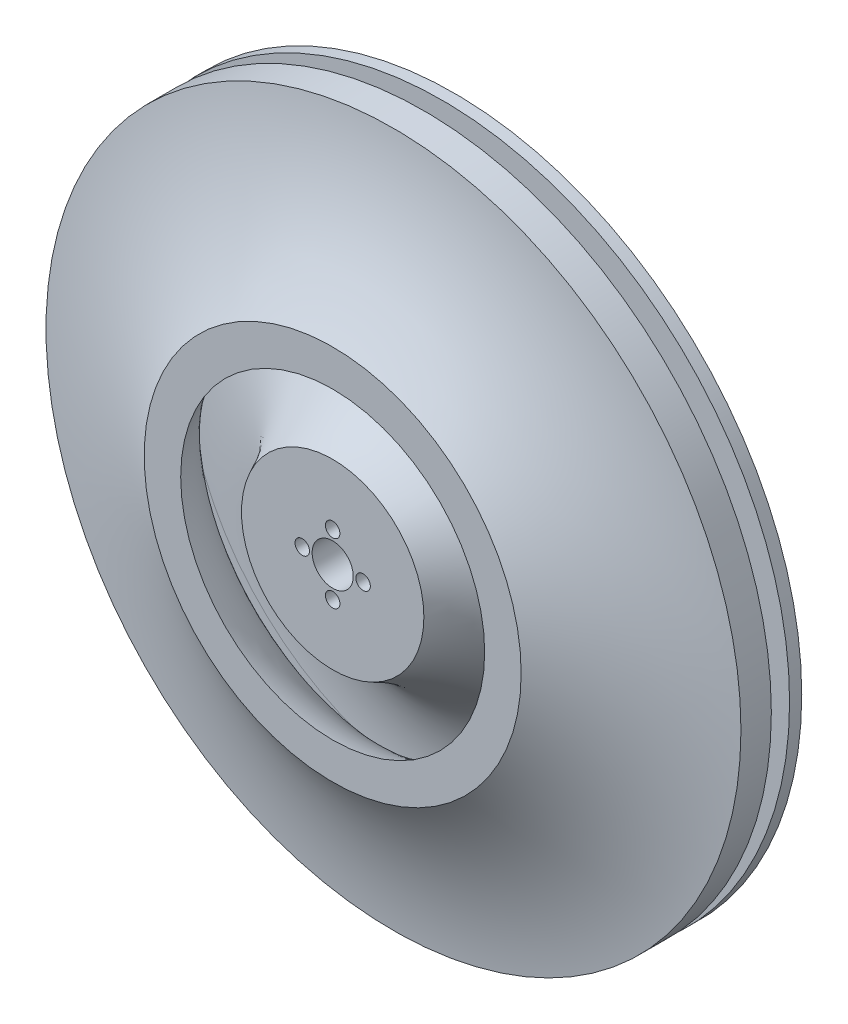
from build123d import *

# Parameters (mm, degrees)
CUT_EXTRUDE1_DEPTH      = 84.260104492
CUT_EXTRUDE1_DEPTH_BACK = 84.260104492
SKETCH2_R               = 1.190625
SKETCH2_R_2             = 3.3782


with BuildPart() as part:
    # Sketch1 → Revolve1 (revolve)
    with BuildSketch(Plane.YZ, mode=Mode.PRIVATE) as revolve1_sk:
        with BuildLine():
            Line((-57.15, 10), (-57.15, 5))
            Line((-57.15, 5), (-42.15, 6.312329953))
            ThreePointArc((-42.15, 6.312329953), (-31.509122685, 10.567718891), (-25, 20))
            Line((-25, 20), (-31, 20))
            ThreePointArc((-31, 20), (-43.428055952, 13.308241315), (-57.15, 10))
        make_face()
        with BuildLine():
            ThreePointArc((-42.15, 2), (-25.862562356, 6.908739887), (-15, 20))
            Line((-15, 20), (0, 20))
            Line((0, 20), (0, -15))
            Line((0, -15), (-12.5, -15))
            Line((-12.5, -15), (-12.5, 0))
            Line((-12.5, 0), (-22.775, 0))
            Line((-22.775, 0), (-22.775, 1))
            Line((-22.775, 1), (-25.025, 1))
            Line((-25.025, 1), (-25.025, 0))
            Line((-25.025, 0), (-26.775, 0))
            Line((-26.775, 0), (-26.775, 1))
            Line((-26.775, 1), (-29.025, 1))
            Line((-29.025, 1), (-29.025, 0))
            Line((-29.025, 0), (-30.775, 0))
            Line((-30.775, 0), (-30.775, 1))
            Line((-30.775, 1), (-33.025, 1))
            Line((-33.025, 1), (-33.025, 0))
            Line((-33.025, 0), (-34.775, 0))
            Line((-34.775, 0), (-34.775, 1))
            Line((-34.775, 1), (-37.025, 1))
            Line((-37.025, 1), (-37.025, 0))
            Line((-37.025, 0), (-57.15, 0))
            Line((-57.15, 0), (-57.15, 2))
            Line((-57.15, 2), (-42.15, 2))
        make_face()
    revolve(revolve1_sk.sketch.rotate(Axis((0, 0, 21), (0, 0, -1)), 270), axis=Axis((0, 0, 21), (0, 0, -1)))

    # Sketch2 → Cut-Extrude1 (cut, two sides: drawn at the far end of the back side and taken through both)
    with BuildSketch(Plane(origin=(0, 0, 0), x_dir=(0, 1, 0), z_dir=(0, 0, 1)).offset(-CUT_EXTRUDE1_DEPTH_BACK)):
        with Locations(Location((-5, 0, 0), (0, 0, 270))):
            Circle(SKETCH2_R)
        with Locations(Location((0, 5, 0), (0, 0, 270))):
            Circle(SKETCH2_R)
        with Locations(Location((5, 0, 0), (0, 0, 270))):
            Circle(SKETCH2_R)
        with Locations(Location((0, -5, 0), (0, 0, 270))):
            Circle(SKETCH2_R)
        with Locations(Location((0, 0, 0), (0, 0, 270))):
            Circle(SKETCH2_R_2)
    extrude(amount=CUT_EXTRUDE1_DEPTH + CUT_EXTRUDE1_DEPTH_BACK, mode=Mode.SUBTRACT)


solid = part.part
